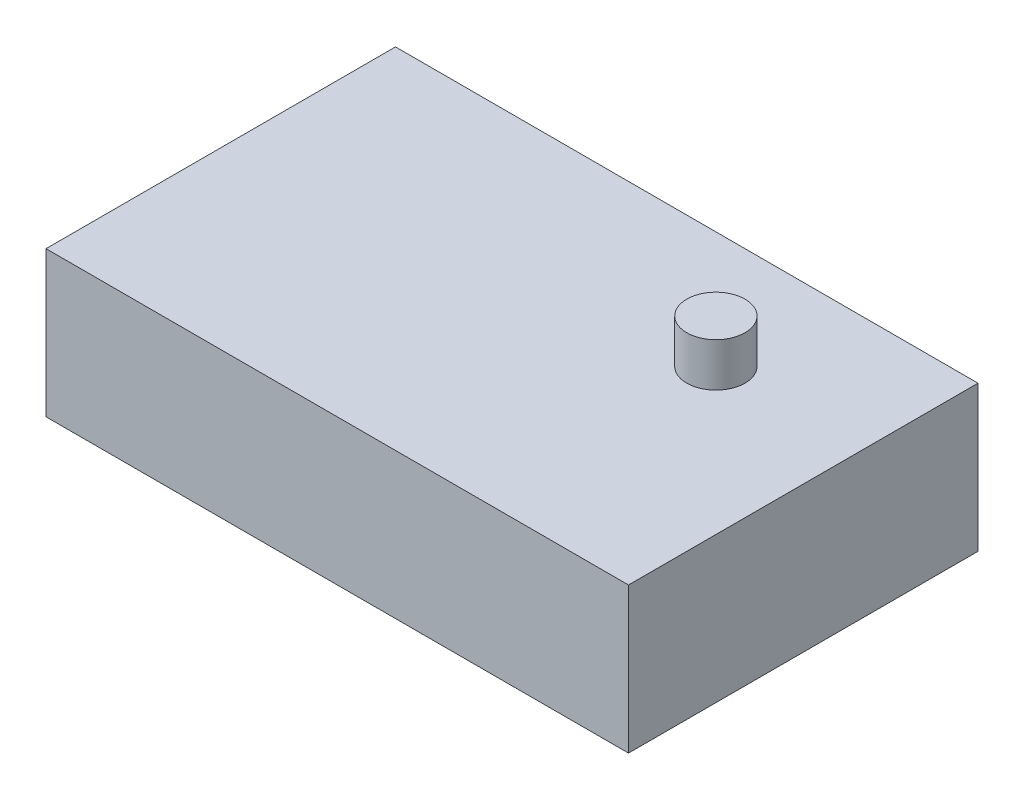
from build123d import *

# Parameters (mm, degrees)
SKETCH1_W           = 20
SKETCH1_H           = 12
BOSS_EXTRUDE1_DEPTH = 5
SKETCH2_R           = 1
BOSS_EXTRUDE2_DEPTH = 1.5


with BuildPart() as part:
    # Sketch1 → Boss-Extrude1 (new body)
    with BuildSketch(Plane(origin=(0, 0, 0), x_dir=(1, 0, 0), z_dir=(0, 1, 0))):
        Rectangle(SKETCH1_W, SKETCH1_H)
    extrude(amount=BOSS_EXTRUDE1_DEPTH)

    # Sketch2 → Boss-Extrude2 (add)
    with BuildSketch(Plane(origin=(0, 5, 0), x_dir=(1, 0, 0), z_dir=(0, 1, 0))):
        with Locations(Location((5, 2, 0), (0, 0, 270))):
            Circle(SKETCH2_R)
    extrude(amount=BOSS_EXTRUDE2_DEPTH)


solid = part.part
